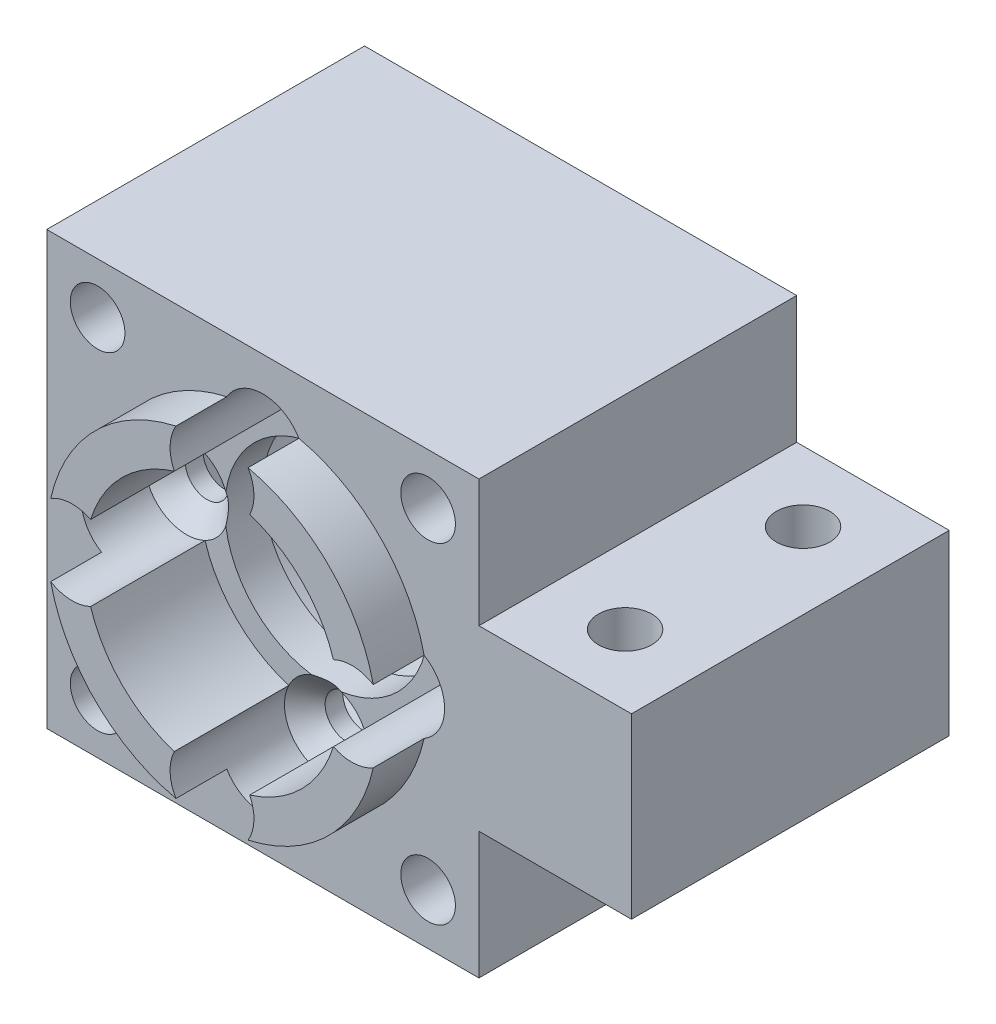
from build123d import *

# Parameters (mm, degrees)
HOLE_WIZARD_1_AT_2_COUNT  = 2
HOLE_WIZARD_1_AT_2_PITCH  = 15.556349186
HOLE_WIZARD_1_AT_3_COUNT  = 2
HOLE_WIZARD_1_AT_3_PITCH  = 22
HOLE_WIZARD_1_AT_4_COUNT  = 2
HOLE_WIZARD_1_AT_4_PITCH  = 15.556349186
SKETCH_4_W                = 34
SKETCH_4_H                = 34
SKETCH_4_R                = 16
EXTRUDE_1_DEPTH           = 25
HOLE_WIZARD_2_D           = 4.3
HOLE_WIZARD_2_CBORE_D     = 7.5
HOLE_WIZARD_2_CBORE_DEPTH = 11
SKETCH_25_W               = 12
SKETCH_25_H               = 25
EXTRUDE_4_DEPTH           = 7
HOLE_WIZARD_M5_1_D        = 4.2


with BuildPart() as part:
    # 草图1 → 旋转1 (revolve)
    with BuildSketch(Plane(origin=(0, 0, 0), x_dir=(0, 0, -1), z_dir=(1, 0, 0)), mode=Mode.PRIVATE) as revolve_1_sk:
        Polygon((0, 13), (0, 10), (9, 10), (9, 8), (12, 8), (12, 14), (29, 14), (29, 16), (4, 16), (4, 13), align=None)
    revolve(revolve_1_sk.sketch.rotate(Axis((0, 0, 0), (0, 0, -1)), 90), axis=Axis((0, 0, 0), (0, 0, -1)))

    # 草图2 → 打孔尺寸(%根据十字)槽沉头木螺钉的类型1 (revolve, cut)
    with BuildSketch(Plane(origin=(11, 0, 0), x_dir=(0, -1, 0), z_dir=(1, 0, 0))):
        Polygon((0, 0), (0, 29), (1.7, 29), (1.7, 10.6), (3.3, 9), (3.3, 0), align=None)
    hole_wizard_1 = revolve(axis=Axis((11, 0, 6.35), (0, 0, -1)), mode=Mode.SUBTRACT)

    # 打孔尺寸(%根据十字)槽沉头木螺钉的类型1 at 2: 打孔尺寸(%根据十字)槽沉头木螺钉的类型1 ×2
    with Locations(*[Vector(-0.7071067811865476, -0.7071067811865476, 0) * (i * HOLE_WIZARD_1_AT_2_PITCH) for i in range(1, HOLE_WIZARD_1_AT_2_COUNT)]):
        add(hole_wizard_1, mode=Mode.SUBTRACT)

    # 打孔尺寸(%根据十字)槽沉头木螺钉的类型1 at 3: 打孔尺寸(%根据十字)槽沉头木螺钉的类型1 ×2
    with Locations(*[(-i * HOLE_WIZARD_1_AT_3_PITCH, 0, 0) for i in range(1, HOLE_WIZARD_1_AT_3_COUNT)]):
        add(hole_wizard_1, mode=Mode.SUBTRACT)

    # 打孔尺寸(%根据十字)槽沉头木螺钉的类型1 at 4: 打孔尺寸(%根据十字)槽沉头木螺钉的类型1 ×2
    with Locations(*[Vector(-0.7071067811865476, 0.7071067811865475, 0) * (i * HOLE_WIZARD_1_AT_4_PITCH) for i in range(1, HOLE_WIZARD_1_AT_4_COUNT)]):
        add(hole_wizard_1, mode=Mode.SUBTRACT)

    # 草图4 → 凸台-拉伸1 (add)
    with BuildSketch(Plane.XY.offset(-4)):
        Rectangle(SKETCH_4_W, SKETCH_4_H)
        Circle(SKETCH_4_R, mode=Mode.SUBTRACT)
    extrude(amount=-EXTRUDE_1_DEPTH)

    # 打孔尺寸(%根据)内六角圆柱头螺钉的类型2 (through all)
    with Locations(Plane(origin=(0, 0, -29), x_dir=(-1, 0, 0), z_dir=(0, 0, -1))):
        with Locations((13, 13), (13, -13), (-13, -13), (-13, 13)):
            CounterBoreHole(HOLE_WIZARD_2_D / 2, HOLE_WIZARD_2_CBORE_D / 2, HOLE_WIZARD_2_CBORE_DEPTH)

    # 草图25 → 凸台-拉伸4 (add, symmetric)
    with BuildSketch(Plane(origin=(0, 0, 0), x_dir=(1, 0, 0), z_dir=(0, 1, 0))):
        with Locations((23, 16.5)):
            Rectangle(SKETCH_25_W, SKETCH_25_H)
    extrude(amount=EXTRUDE_4_DEPTH, both=True)

    # M5 螺纹孔1 (through all)
    with Locations(Plane(origin=(0, 7, 0), x_dir=(1, 0, 0), z_dir=(0, 1, 0))):
        with Locations((23, 23.5), (23, 9.5)):
            Hole(HOLE_WIZARD_M5_1_D / 2)


solid = part.part
